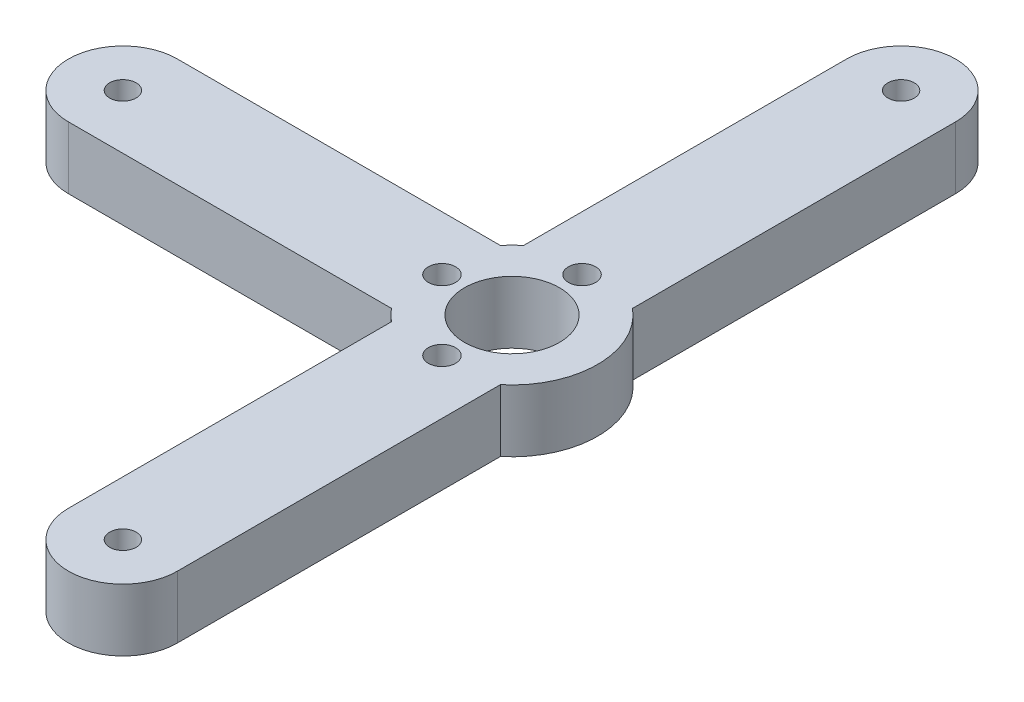
from build123d import *

# Parameters (mm, degrees)
BASE_OUTLINE_SKETCH_R          = 6.1
BASE_OUTLINE_SKETCH_R_2        = 3.1
BASE_OUTLINE_DEPTH             = 1
INTERFACE_PROFILE_2_SKETCH_R   = 6.1
INTERFACE_PROFILE_2_SKETCH_R_2 = 3.1
INTERFACE_PROFILE_2_SKETCH_R_3 = 1.1
INTERFACE_PROFILE_2_DEPTH      = 0.6
INTERFACE_PROFILE_3_SKETCH_R   = 1.7
INTERFACE_PROFILE_3_SKETCH_R_2 = 6.1
INTERFACE_PROFILE_3_SKETCH_R_3 = 1.1
INTERFACE_PROFILE_3_DEPTH      = 2.4
INTERFACE_PROFILE_4_SKETCH_R   = 1.7
INTERFACE_PROFILE_4_SKETCH_R_2 = 1.75
INTERFACE_PROFILE_4_SKETCH_R_3 = 6.1
INTERFACE_PROFILE_4_DEPTH      = 4


with BuildPart() as part:
    # Base Outline Sketch → Base Outline (new body)
    with BuildSketch(Plane(origin=(0, 149, 0), x_dir=(1, 0, 0), z_dir=(0, 1, 0))):
        with BuildLine():
            Line((-64.77693262, -7), (-106.291651246, -7))
            ThreePointArc((-106.291651246, -7), (-113.291651246, 0), (-106.291651246, 7))
            Line((-106.291651246, 7), (-64.77693262, 7))
            ThreePointArc((-64.77693262, 7), (-64.069825839, 7.778174593), (-63.291651246, 8.485281374))
            Line((-63.291651246, 8.485281374), (-63.291651246, 50))
            ThreePointArc((-63.291651246, 50), (-56.291651246, 57), (-49.291651246, 50))
            Line((-49.291651246, 50), (-49.291651246, 8.485281374))
            ThreePointArc((-49.291651246, 8.485281374), (-45.291651246, 0), (-49.291651246, -8.485281374))
            Line((-49.291651246, -8.485281374), (-49.291651246, -50))
            ThreePointArc((-49.291651246, -50), (-56.291651246, -57), (-63.291651246, -50))
            Line((-63.291651246, -50), (-63.291651246, -8.485281374))
            ThreePointArc((-63.291651246, -8.485281374), (-64.069825839, -7.778174593), (-64.77693262, -7))
        make_face()
        with Locations(Location((-56.291651246, 0, 0), (0, 0, 270))):
            Circle(BASE_OUTLINE_SKETCH_R, mode=Mode.SUBTRACT)
        with Locations(Location((-106.291651246, 0, 0), (0, 0, 270))):
            Circle(BASE_OUTLINE_SKETCH_R_2, mode=Mode.SUBTRACT)
        with Locations(Location((-56.291651246, 50, 0), (0, 0, 270))):
            Circle(BASE_OUTLINE_SKETCH_R_2, mode=Mode.SUBTRACT)
        with Locations(Location((-56.291651246, -50, 0), (0, 0, 270))):
            Circle(BASE_OUTLINE_SKETCH_R_2, mode=Mode.SUBTRACT)
    extrude(amount=BASE_OUTLINE_DEPTH)

    # Interface Profile 2 Sketch → Interface Profile 2 (add)
    with BuildSketch(Plane(origin=(0, 150, 0), x_dir=(1, 0, 0), z_dir=(0, 1, 0))):
        with BuildLine():
            Line((-64.77693262, -7), (-106.291651246, -7))
            ThreePointArc((-106.291651246, -7), (-113.291651246, 0), (-106.291651246, 7))
            Line((-106.291651246, 7), (-64.77693262, 7))
            ThreePointArc((-64.77693262, 7), (-64.069825839, 7.778174593), (-63.291651246, 8.485281374))
            Line((-63.291651246, 8.485281374), (-63.291651246, 50))
            ThreePointArc((-63.291651246, 50), (-56.291651246, 57), (-49.291651246, 50))
            Line((-49.291651246, 50), (-49.291651246, 8.485281374))
            ThreePointArc((-49.291651246, 8.485281374), (-45.291651246, 0), (-49.291651246, -8.485281374))
            Line((-49.291651246, -8.485281374), (-49.291651246, -50))
            ThreePointArc((-49.291651246, -50), (-56.291651246, -57), (-63.291651246, -50))
            Line((-63.291651246, -50), (-63.291651246, -8.485281374))
            ThreePointArc((-63.291651246, -8.485281374), (-64.069825839, -7.778174593), (-64.77693262, -7))
        make_face()
        with Locations(Location((-56.291651246, 0, 0), (0, 0, 270))):
            Circle(INTERFACE_PROFILE_2_SKETCH_R, mode=Mode.SUBTRACT)
        with Locations(Location((-106.291651246, 0, 0), (0, 0, 270))):
            Circle(INTERFACE_PROFILE_2_SKETCH_R_2, mode=Mode.SUBTRACT)
        with Locations(Location((-56.291651246, 50, 0), (0, 0, 270))):
            Circle(INTERFACE_PROFILE_2_SKETCH_R_2, mode=Mode.SUBTRACT)
        with Locations(Location((-56.291651246, -50, 0), (0, 0, 270))):
            Circle(INTERFACE_PROFILE_2_SKETCH_R_2, mode=Mode.SUBTRACT)
        with Locations(Location((-56.291651246, 9, 0), (0, 0, 270))):
            Circle(INTERFACE_PROFILE_2_SKETCH_R_3, mode=Mode.SUBTRACT)
        with Locations(Location((-65.291651246, 0, 0), (0, 0, 270))):
            Circle(INTERFACE_PROFILE_2_SKETCH_R_3, mode=Mode.SUBTRACT)
        with Locations(Location((-56.291651246, -9, 0), (0, 0, 270))):
            Circle(INTERFACE_PROFILE_2_SKETCH_R_3, mode=Mode.SUBTRACT)
    extrude(amount=INTERFACE_PROFILE_2_DEPTH)

    # Interface Profile 3 Sketch → Interface Profile 3 (add)
    with BuildSketch(Plane(origin=(0, 150.6, 0), x_dir=(1, 0, 0), z_dir=(0, 1, 0))):
        with BuildLine():
            Line((-64.77693262, -7), (-106.291651246, -7))
            ThreePointArc((-106.291651246, -7), (-113.291651246, 0), (-106.291651246, 7))
            Line((-106.291651246, 7), (-64.77693262, 7))
            ThreePointArc((-64.77693262, 7), (-64.069825839, 7.778174593), (-63.291651246, 8.485281374))
            Line((-63.291651246, 8.485281374), (-63.291651246, 50))
            ThreePointArc((-63.291651246, 50), (-56.291651246, 57), (-49.291651246, 50))
            Line((-49.291651246, 50), (-49.291651246, 8.485281374))
            ThreePointArc((-49.291651246, 8.485281374), (-45.291651246, 0), (-49.291651246, -8.485281374))
            Line((-49.291651246, -8.485281374), (-49.291651246, -50))
            ThreePointArc((-49.291651246, -50), (-56.291651246, -57), (-63.291651246, -50))
            Line((-63.291651246, -50), (-63.291651246, -8.485281374))
            ThreePointArc((-63.291651246, -8.485281374), (-64.069825839, -7.778174593), (-64.77693262, -7))
        make_face()
        with Locations(Location((-106.291651246, 0, 0), (0, 0, 270))):
            Circle(INTERFACE_PROFILE_3_SKETCH_R, mode=Mode.SUBTRACT)
        with Locations(Location((-56.291651246, 50, 0), (0, 0, 270))):
            Circle(INTERFACE_PROFILE_3_SKETCH_R, mode=Mode.SUBTRACT)
        with Locations(Location((-56.291651246, 0, 0), (0, 0, 270))):
            Circle(INTERFACE_PROFILE_3_SKETCH_R_2, mode=Mode.SUBTRACT)
        with Locations(Location((-56.291651246, -50, 0), (0, 0, 270))):
            Circle(INTERFACE_PROFILE_3_SKETCH_R, mode=Mode.SUBTRACT)
        with Locations(Location((-56.291651246, 9, 0), (0, 0, 270))):
            Circle(INTERFACE_PROFILE_3_SKETCH_R_3, mode=Mode.SUBTRACT)
        with Locations(Location((-65.291651246, 0, 0), (0, 0, 270))):
            Circle(INTERFACE_PROFILE_3_SKETCH_R_3, mode=Mode.SUBTRACT)
        with Locations(Location((-56.291651246, -9, 0), (0, 0, 270))):
            Circle(INTERFACE_PROFILE_3_SKETCH_R_3, mode=Mode.SUBTRACT)
    extrude(amount=INTERFACE_PROFILE_3_DEPTH)

    # Interface Profile 4 Sketch → Interface Profile 4 (add)
    with BuildSketch(Plane(origin=(0, 153, 0), x_dir=(1, 0, 0), z_dir=(0, 1, 0))):
        with BuildLine():
            Line((-64.77693262, -7), (-106.291651246, -7))
            ThreePointArc((-106.291651246, -7), (-113.291651246, 0), (-106.291651246, 7))
            Line((-106.291651246, 7), (-64.77693262, 7))
            ThreePointArc((-64.77693262, 7), (-64.069825839, 7.778174593), (-63.291651246, 8.485281374))
            Line((-63.291651246, 8.485281374), (-63.291651246, 50))
            ThreePointArc((-63.291651246, 50), (-56.291651246, 57), (-49.291651246, 50))
            Line((-49.291651246, 50), (-49.291651246, 8.485281374))
            ThreePointArc((-49.291651246, 8.485281374), (-45.291651246, 0), (-49.291651246, -8.485281374))
            Line((-49.291651246, -8.485281374), (-49.291651246, -50))
            ThreePointArc((-49.291651246, -50), (-56.291651246, -57), (-63.291651246, -50))
            Line((-63.291651246, -50), (-63.291651246, -8.485281374))
            ThreePointArc((-63.291651246, -8.485281374), (-64.069825839, -7.778174593), (-64.77693262, -7))
        make_face()
        with Locations(Location((-106.291651246, 0, 0), (0, 0, 270))):
            Circle(INTERFACE_PROFILE_4_SKETCH_R, mode=Mode.SUBTRACT)
        with Locations(Location((-56.291651246, 50, 0), (0, 0, 270))):
            Circle(INTERFACE_PROFILE_4_SKETCH_R, mode=Mode.SUBTRACT)
        with Locations(Location((-56.291651246, 9, 0), (0, 0, 270))):
            Circle(INTERFACE_PROFILE_4_SKETCH_R_2, mode=Mode.SUBTRACT)
        with Locations(Location((-65.291651246, 0, 0), (0, 0, 270))):
            Circle(INTERFACE_PROFILE_4_SKETCH_R_2, mode=Mode.SUBTRACT)
        with Locations(Location((-56.291651246, 0, 0), (0, 0, 270))):
            Circle(INTERFACE_PROFILE_4_SKETCH_R_3, mode=Mode.SUBTRACT)
        with Locations(Location((-56.291651246, -9, 0), (0, 0, 270))):
            Circle(INTERFACE_PROFILE_4_SKETCH_R_2, mode=Mode.SUBTRACT)
        with Locations(Location((-56.291651246, -50, 0), (0, 0, 270))):
            Circle(INTERFACE_PROFILE_4_SKETCH_R, mode=Mode.SUBTRACT)
    extrude(amount=INTERFACE_PROFILE_4_DEPTH)


solid = part.part
